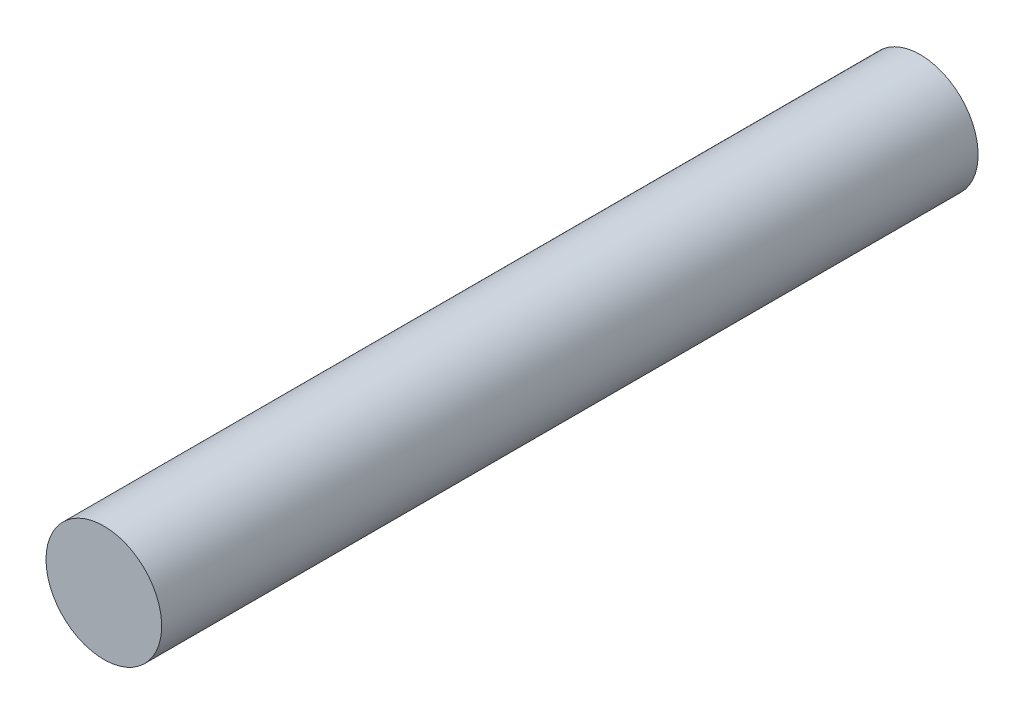
from build123d import *

# Parameters (mm, degrees)
SKETCH1_R           = 4.25
BOSS_EXTRUDE1_DEPTH = 60
SKETCH2_R           = 0.5
BOSS_EXTRUDE2_DEPTH = 0.1
CIRPATTERN1_COUNT   = 4


with BuildPart() as part:
    # Sketch1 → Boss-Extrude1 (new body)
    with BuildSketch(Plane.XY):
        with Locations(Location((0, 0, 0), (0, 0, 180))):
            Circle(SKETCH1_R)
    extrude(amount=BOSS_EXTRUDE1_DEPTH)

    # Sketch2 → Boss-Extrude2 (add)
    with BuildSketch(Plane(origin=(0, 0, 0), x_dir=(-1, 0, 0), z_dir=(0, 0, -1))):
        with Locations(Location((-1, 3, 0), (0, 0, 180))):
            Circle(SKETCH2_R)
        with Locations(Location((1, 3, 0), (0, 0, 180))):
            Circle(SKETCH2_R)
    boss_extrude2 = extrude(amount=BOSS_EXTRUDE2_DEPTH)

    # CirPattern1: Boss-Extrude2 ×4 about axis
    cirpattern1_axis = Axis((0, 0, 0), (0, 0, 1))
    for i in range(1, CIRPATTERN1_COUNT):
        add(boss_extrude2.rotate(cirpattern1_axis, i * 360 / CIRPATTERN1_COUNT))


solid = part.part
